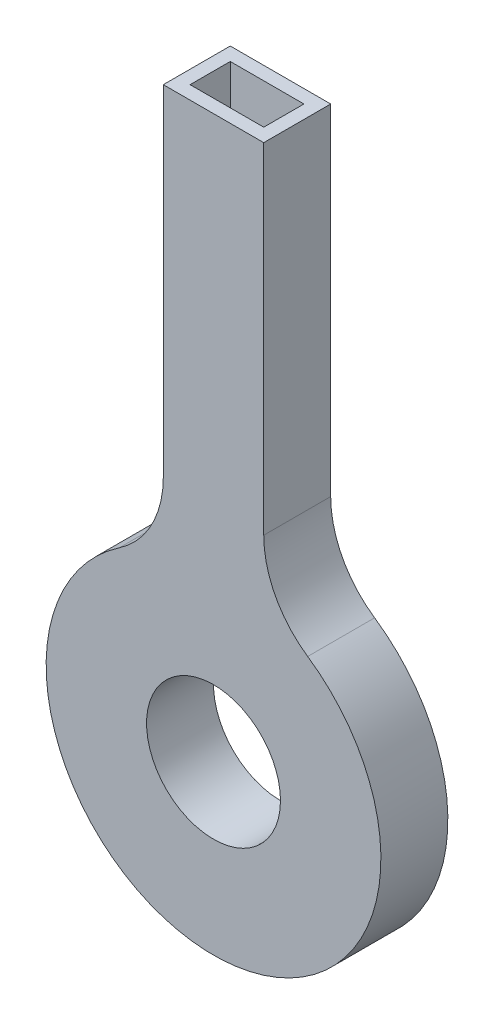
from build123d import *

# Parameters (mm, degrees)
SKETCH1_R           = 25
SKETCH1_R_2         = 10
BOSS_EXTRUDE1_DEPTH = 10
SKETCH2_W           = 15
SKETCH2_H           = 60
BOSS_EXTRUDE2_DEPTH = 10
FILLET1_R           = 15
SKETCH3_W           = 11
SKETCH3_H           = 6
CUT_EXTRUDE1_DEPTH  = 25


with BuildPart() as part:
    # Sketch1 → Boss-Extrude1 (new body)
    with BuildSketch(Plane.XY):
        Circle(SKETCH1_R)
        Circle(SKETCH1_R_2, mode=Mode.SUBTRACT)
    extrude(amount=BOSS_EXTRUDE1_DEPTH)

    # Sketch2 → Boss-Extrude2 (add)
    with BuildSketch(Plane.XY):
        with Locations((0, 53.848480035)):
            Rectangle(SKETCH2_W, SKETCH2_H)
    extrude(amount=BOSS_EXTRUDE2_DEPTH)

    # Fillet1
    fillet1_edges = [part.edges().sort_by_distance(p)[0] for p in [
        (-7.5, 23.848480035, 5),
        (7.5, 23.848480035, 5),
    ]]
    fillet(fillet1_edges, radius=FILLET1_R)

    # Sketch3 → Cut-Extrude1 (cut)
    with BuildSketch(Plane(origin=(0, 83.848480035, 0), x_dir=(1, 0, 0), z_dir=(0, 1, 0))):
        with Locations((0, -5)):
            Rectangle(SKETCH3_W, SKETCH3_H)
    extrude(amount=-CUT_EXTRUDE1_DEPTH, mode=Mode.SUBTRACT)


solid = part.part
